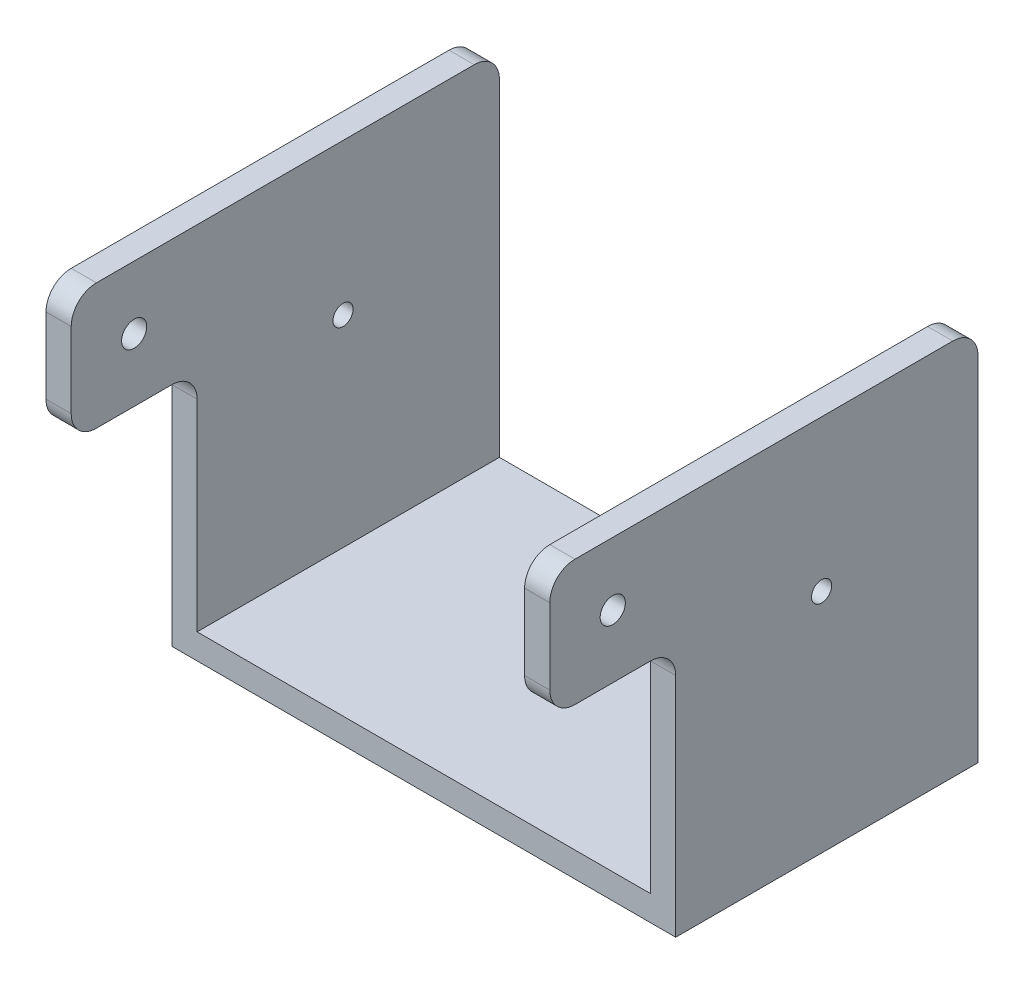
from build123d import *

# Parameters (mm, degrees)
BOSS_EXTRUDE1_DEPTH     = 120
SKETCH2_W               = 10
SKETCH2_H               = 50
BOSS_EXTRUDE2_DEPTH     = 50
SKETCH3_R               = 5
CUT_EXTRUDE1_DEPTH      = 200
FILLET1_R               = 10
SKETCH5_R               = 4
CUT_EXTRUDE2_DEPTH      = 200
SKETCH6_R               = 12.5
SKETCH6_R_2             = 5
BOSS_EXTRUDE3_DEPTH     = 20
CUT_EXTRUDE3_DEPTH      = 12.5
CUT_EXTRUDE3_DEPTH_BACK = 12.5
CUT_EXTRUDE3_START      = 100
SKETCH7_R               = 3


with BuildPart() as part:
    # Sketch1 → Boss-Extrude1 (new body)
    with BuildSketch(Plane.XY):
        Polygon((0, 0), (200, 0), (200, 150), (190, 150), (190, 10), (10, 10), (10, 150), (0, 150), align=None)
    extrude(amount=BOSS_EXTRUDE1_DEPTH)

    # Sketch2 → Boss-Extrude2 (add)
    with BuildSketch(Plane.XY.offset(120)):
        with Locations((5, 125)):
            Rectangle(SKETCH2_W, SKETCH2_H)
        with Locations((195, 125)):
            Rectangle(SKETCH2_W, SKETCH2_H)
    extrude(amount=BOSS_EXTRUDE2_DEPTH)

    # Sketch3 → Cut-Extrude1 (cut)
    with BuildSketch(Plane.ZY):
        with Locations(Location((145, 125, 0), (0, 0, 270))):
            Circle(SKETCH3_R)
    extrude(amount=-CUT_EXTRUDE1_DEPTH, mode=Mode.SUBTRACT)

    # Fillet1
    fillet1_edges = [part.edges().sort_by_distance(p)[0] for p in [
        (195, 150, 0),
        (5, 100, 120),
        (5, 100, 170),
        (5, 150, 170),
        (195, 100, 120),
        (195, 100, 170),
        (195, 150, 170),
        (5, 150, 0),
    ]]
    fillet(fillet1_edges, radius=FILLET1_R)

    # Sketch5 → Cut-Extrude2 (cut)
    with BuildSketch(Plane.ZY):
        with Locations(Location((62.084380241, 90, 0), (0, 0, 270))):
            Circle(SKETCH5_R)
    extrude(amount=-CUT_EXTRUDE2_DEPTH, mode=Mode.SUBTRACT)

    # Sketch6 → Boss-Extrude3 (add)
    with BuildSketch(Plane.XZ):
        with Locations(Location((100, 60, 0), (0, 0, 90))):
            Circle(SKETCH6_R)
        with Locations(Location((100, 60, 0), (0, 0, 270))):
            Circle(SKETCH6_R_2, mode=Mode.SUBTRACT)
    extrude(amount=BOSS_EXTRUDE3_DEPTH)

    # Sketch7 → Cut-Extrude3 (cut, two sides: drawn at the far end of the back side and taken through both)
    with BuildSketch(Plane(origin=(0, 0, 0), x_dir=(0, 0, -1), z_dir=(1, 0, 0)).offset(CUT_EXTRUDE3_START - CUT_EXTRUDE3_DEPTH_BACK)):
        with Locations((-60, -10)):
            Circle(SKETCH7_R)
    extrude(amount=CUT_EXTRUDE3_DEPTH + CUT_EXTRUDE3_DEPTH_BACK, mode=Mode.SUBTRACT)


solid = part.part
